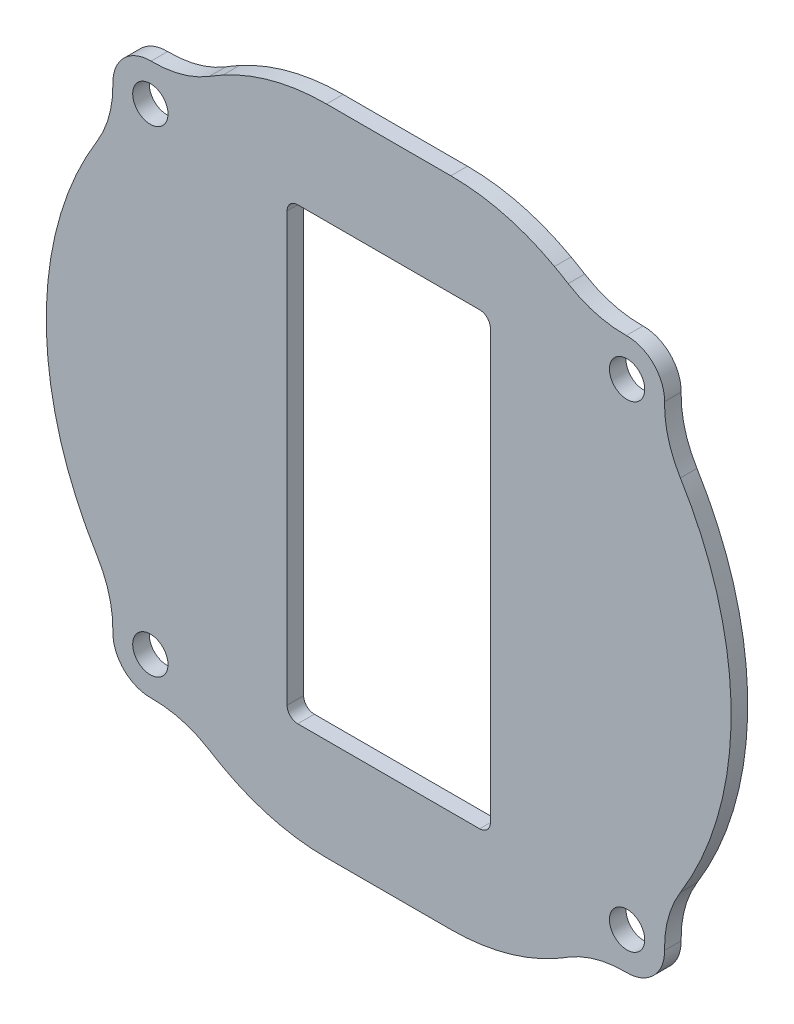
from build123d import *

# Parameters (mm, degrees)
ESQUISSE1_R             = 1.65
BOSS_EXTRU_1_DEPTH      = 1.55
ESQUISSE2_W             = 19
ESQUISSE2_H             = 42
ENL_V_MAT_EXTRU_1_DEPTH = 46.281370341
CONG_1_R                = 10
CONG_2_R                = 1
ESQUISSE3_OUTSIDE_W     = 84.104
ESQUISSE3_OUTSIDE_H     = 84.104
ESQUISSE3_OUTSIDE_W_2   = 70
ESQUISSE3_OUTSIDE_H_2   = 61
ENL_V_MAT_EXTRU_2_DEPTH = 46.281370486
CONG_3_R                = 20


with BuildPart() as part:
    # Esquisse1 → Boss.-Extru.1 (new body)
    with BuildSketch(Plane.XY):
        with BuildLine():
            ThreePointArc((-24.957906965, 20.02755302), (-32, 0), (-24.957906965, -20.02755302))
            ThreePointArc((-24.957906965, -20.02755302), (-24.748737342, -24.748737342), (-20.02755302, -24.957906965))
            ThreePointArc((-20.02755302, -24.957906965), (0, -32), (20.02755302, -24.957906965))
            ThreePointArc((20.02755302, -24.957906965), (24.748737342, -24.748737342), (24.957906965, -20.02755302))
            ThreePointArc((24.957906965, -20.02755302), (32, 0), (24.957906965, 20.02755302))
            ThreePointArc((24.957906965, 20.02755302), (24.748737342, 24.748737342), (20.02755302, 24.957906965))
            ThreePointArc((20.02755302, 24.957906965), (0, 32), (-20.02755302, 24.957906965))
            ThreePointArc((-20.02755302, 24.957906965), (-24.748737342, 24.748737342), (-24.957906965, 20.02755302))
        make_face()
        with Locations(Location((-22.273863607, 22.273863607, 0), (0, 0, 180))):
            Circle(ESQUISSE1_R, mode=Mode.SUBTRACT)
        with Locations(Location((22.273863607, 22.273863607, 0), (0, 0, 180))):
            Circle(ESQUISSE1_R, mode=Mode.SUBTRACT)
        with Locations(Location((22.273863607, -22.273863607, 0), (0, 0, 180))):
            Circle(ESQUISSE1_R, mode=Mode.SUBTRACT)
        with Locations(Location((-22.273863607, -22.273863607, 0), (0, 0, 180))):
            Circle(ESQUISSE1_R, mode=Mode.SUBTRACT)
    extrude(amount=BOSS_EXTRU_1_DEPTH)

    # Esquisse2 → Enlèv. mat.-Extru.1 (cut, through all)
    with BuildSketch(Plane.XY.offset(1.55)):
        Rectangle(ESQUISSE2_W, ESQUISSE2_H)
    extrude(amount=-ENL_V_MAT_EXTRU_1_DEPTH, mode=Mode.SUBTRACT)

    # Congé1
    cong_1_edges = [part.edges().sort_by_distance(p)[0] for p in [
        (20.02755302, 24.957906965, 0.775),
        (24.957906965, 20.02755302, 0.775),
        (24.957906965, -20.02755302, 0.775),
        (20.02755302, -24.957906965, 0.775),
        (-20.02755302, -24.957906965, 0.775),
        (-24.957906965, -20.02755302, 0.775),
        (-24.957906965, 20.02755302, 0.775),
        (-20.02755302, 24.957906965, 0.775),
    ]]
    fillet(cong_1_edges, radius=CONG_1_R)

    # Congé2
    cong_2_edges = [part.edges().sort_by_distance(p)[0] for p in [
        (-9.5, -21, 0.775),
        (-9.5, 21, 0.775),
        (9.5, 21, 0.775),
        (9.5, -21, 0.775),
    ]]
    fillet(cong_2_edges, radius=CONG_2_R)

    # Esquisse3 outside → Enlèv. mat.-Extru.2 (cut, through all)
    with BuildSketch(Plane.XY.offset(1.55)):
        Rectangle(ESQUISSE3_OUTSIDE_W, ESQUISSE3_OUTSIDE_H)
        Rectangle(ESQUISSE3_OUTSIDE_W_2, ESQUISSE3_OUTSIDE_H_2, mode=Mode.SUBTRACT)
    extrude(amount=-ENL_V_MAT_EXTRU_2_DEPTH, mode=Mode.SUBTRACT)

    # Congé3
    cong_3_edges = [part.edges().sort_by_distance(p)[0] for p in [
        (9.682458366, -30.5, 0.775),
        (-9.682458366, -30.5, 0.775),
        (-9.682458366, 30.5, 0.775),
        (9.682458366, 30.5, 0.775),
    ]]
    fillet(cong_3_edges, radius=CONG_3_R)


solid = part.part
